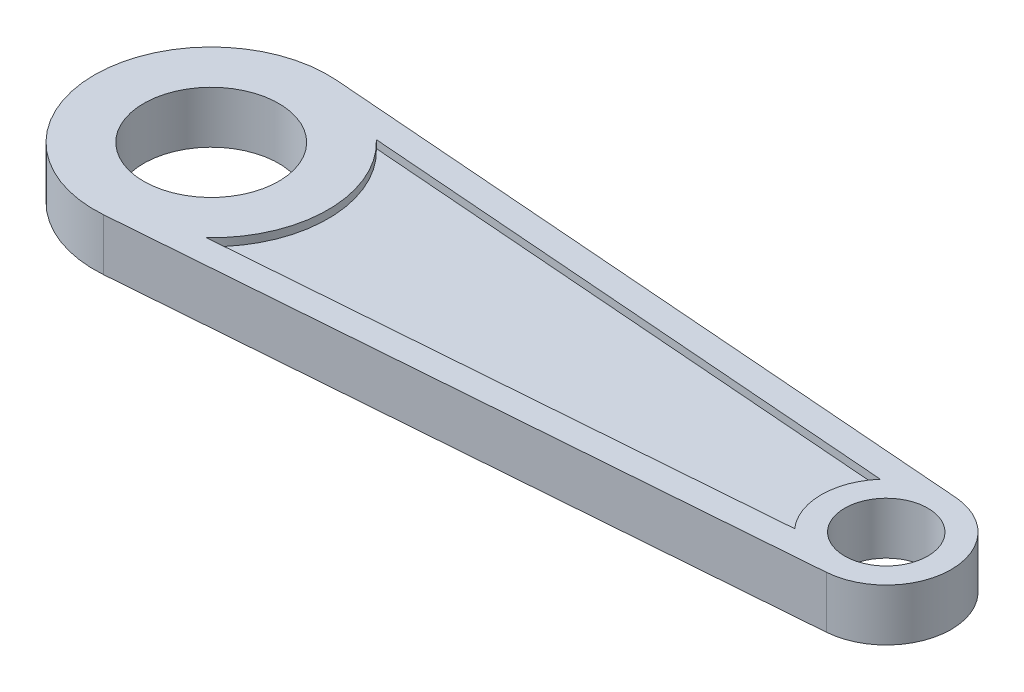
from build123d import *

# Parameters (mm, degrees)
SKETCH1_R           = 13
SKETCH1_R_2         = 8
BOSS_EXTRUDE2_DEPTH = 10
CUT_EXTRUDE1_START  = -1.5
CUT_EXTRUDE1_DEPTH  = 1.5
CUT_EXTRUDE2_DEPTH  = 1.5


with BuildPart() as part:
    # Sketch1 → Boss-Extrude2 (new body)
    with BuildSketch(Plane(origin=(0, 0, 0), x_dir=(1, 0, 0), z_dir=(0, 1, 0))):
        with BuildLine():
            ThreePointArc((1.730769231, 22.433333187), (-22.5, 0), (1.730769231, -22.433333187))
            Line((1.730769231, -22.433333187), (130.961538462, -12.462962882))
            ThreePointArc((130.961538462, -12.462962882), (142.5, 0), (130.961538462, 12.462962882))
            Line((130.961538462, 12.462962882), (1.730769231, 22.433333187))
        make_face()
        with Locations(Location((0, 0, 0), (0, 0, 270))):
            Circle(SKETCH1_R, mode=Mode.SUBTRACT)
        with Locations(Location((130, 0, 0), (0, 0, 270))):
            Circle(SKETCH1_R_2, mode=Mode.SUBTRACT)
    extrude(amount=BOSS_EXTRUDE2_DEPTH)

    # Sketch3 → Cut-Extrude1 (cut)
    with BuildSketch(Plane(origin=(0, 10, 0), x_dir=(1, 0, 0), z_dir=(0, 1, 0)).offset(CUT_EXTRUDE1_START)):
        with BuildLine():
            Line((15.446386754, 16.360291448), (120.606552772, 8.247008498))
            ThreePointArc((120.606552772, 8.247008498), (117.5, 0), (120.606552772, -8.247008498))
            Line((120.606552772, -8.247008498), (15.446386754, -16.360291448))
            ThreePointArc((15.446386754, -16.360291448), (22.5, 0), (15.446386754, 16.360291448))
        make_face()
    extrude(amount=CUT_EXTRUDE1_DEPTH, mode=Mode.SUBTRACT)

    # Sketch5 → Cut-Extrude2 (cut)
    with BuildSketch(Plane.XZ):
        with BuildLine():
            Line((15.446386754, 16.360291448), (120.606552772, 8.247008498))
            ThreePointArc((120.606552772, 8.247008498), (117.5, 0), (120.606552772, -8.247008498))
            Line((120.606552772, -8.247008498), (15.446386754, -16.360291448))
            ThreePointArc((15.446386754, -16.360291448), (22.5, 0), (15.446386754, 16.360291448))
        make_face()
    extrude(amount=-CUT_EXTRUDE2_DEPTH, mode=Mode.SUBTRACT)


solid = part.part
